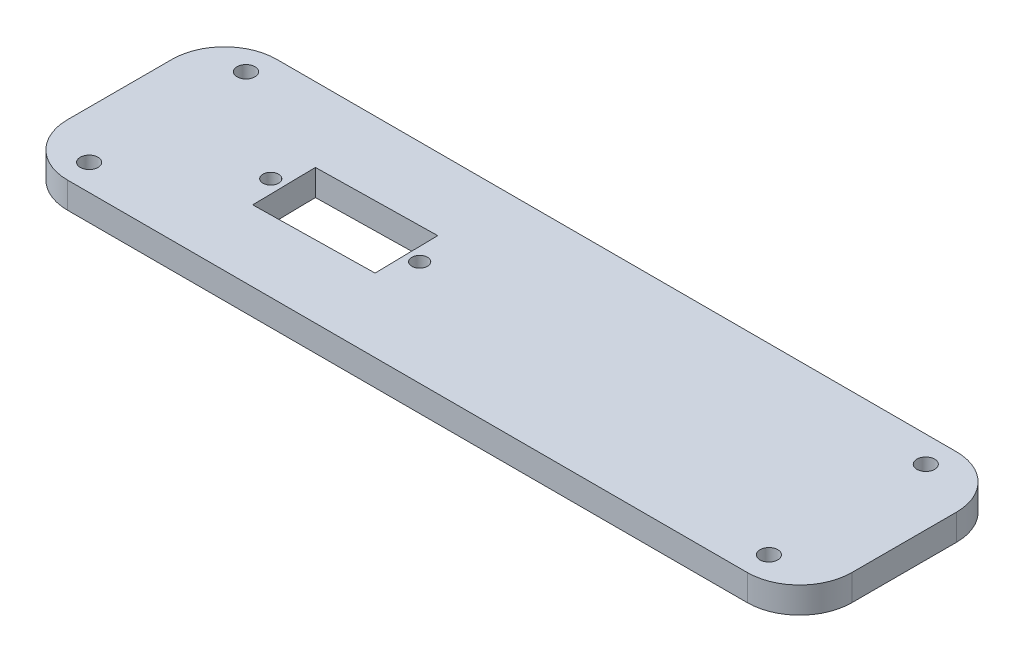
from build123d import *

# Parameters (mm, degrees)
SKETCH9_W           = 150
SKETCH9_H           = 40
BOSS_EXTRUDE5_DEPTH = 5
SKETCH11_R          = 1.7
CUT_EXTRUDE6_DEPTH  = 103.952823134
FILLET1_R           = 10
SKETCH13_R          = 1.5
CUT_EXTRUDE7_DEPTH  = 103.952823134


with BuildPart() as part:
    # Sketch9 → Boss-Extrude5 (new body)
    with BuildSketch(Plane(origin=(0, 0, 0), x_dir=(1, 0, 0), z_dir=(0, 1, 0))):
        with Locations((25.867654831, 0)):
            Rectangle(SKETCH9_W, SKETCH9_H)
    extrude(amount=BOSS_EXTRUDE5_DEPTH)

    # Sketch11 → Cut-Extrude6 (cut, through all)
    with BuildSketch(Plane(origin=(0, 5, 0), x_dir=(1, 0, 0), z_dir=(0, 1, 0))):
        with Locations(Location((-40, 15, 0), (0, 0, 270))):
            Circle(SKETCH11_R)
        with Locations(Location((90, 15, 0), (0, 0, 270))):
            Circle(SKETCH11_R)
        with Locations(Location((90, -15, 0), (0, 0, 270))):
            Circle(SKETCH11_R)
        with Locations(Location((-40, -15, 0), (0, 0, 270))):
            Circle(SKETCH11_R)
    extrude(amount=-CUT_EXTRUDE6_DEPTH, mode=Mode.SUBTRACT)

    # Fillet1
    fillet1_edges = [part.edges().sort_by_distance(p)[0] for p in [
        (100.867654831, 2.5, 20),
        (-49.132345169, 2.5, 20),
        (-49.132345169, 2.5, -20),
        (100.867654831, 2.5, -20),
    ]]
    fillet(fillet1_edges, radius=FILLET1_R)

    # Sketch13 → Cut-Extrude7 (cut, through all)
    with BuildSketch(Plane.XZ):
        with Locations(Location((8.073804278, -0.138958576, 0), (0, 0, 270))):
            Circle(SKETCH13_R)
        with Locations(Location((-19.922049564, 0.342879212, 0), (0, 0, 270))):
            Circle(SKETCH13_R)
        Polygon((-17.527391561, -5.799238749), (-17.317447953, 6.398954711), (5.679146274, 6.003159385), (5.469202666, -6.195034075), align=None)
    extrude(amount=-CUT_EXTRUDE7_DEPTH, mode=Mode.SUBTRACT)


solid = part.part
